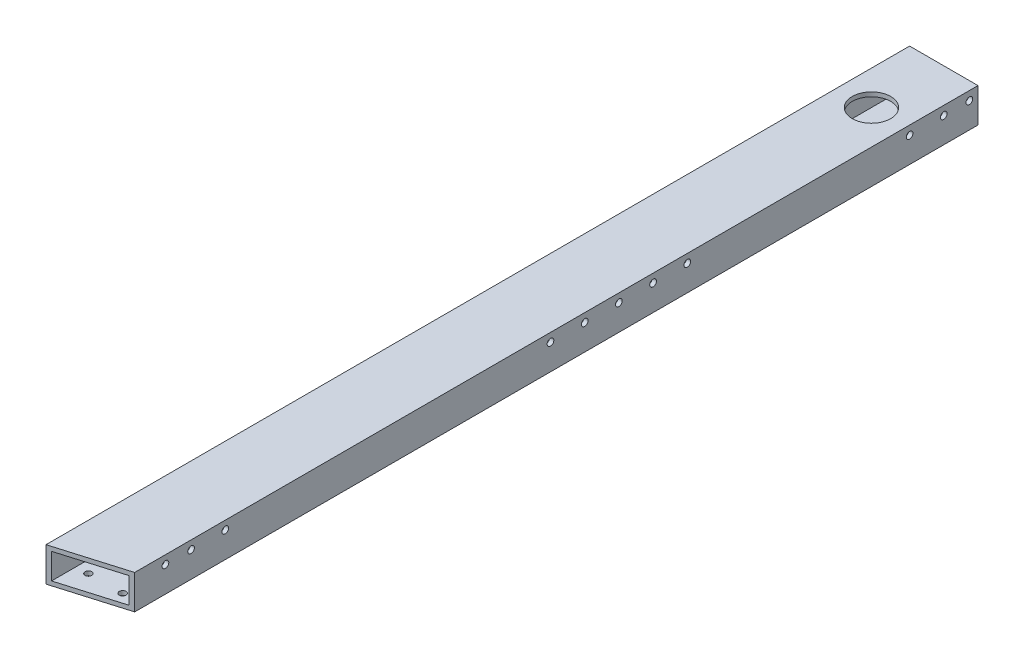
from build123d import *

# Parameters (mm, degrees)
BOSS_EXTRUDE1_DEPTH        = 320.675
BOSS_EXTRUDE1_DEPTH_BACK   = 320.675
SKETCH3_W                  = 50.8
SKETCH3_H                  = 25.4
SKETCH3_W_2                = 44.45
SKETCH3_H_2                = 19.05
CUT_EXTRUDE1_DEPTH         = 323.680609311
CUT_EXTRUDE1_DEPTH_BACK    = 323.680609311
SKETCH8_R                  = 14.2875
CUT_EXTRUDE2_DEPTH         = 323.680609311
F_10_CLEARANCE_HOLE1_D     = 4.9784
F_10_CLEARANCE_HOLE1_DEPTH = 5.08
F_10_CLEARANCE_HOLE1_TIP   = 1.495662253
F_10_CLEARANCE_HOLE2_D     = 4.9784
F_10_CLEARANCE_HOLE2_DEPTH = 3.302
F_10_CLEARANCE_HOLE2_TIP   = 1.495662253
F_10_CLEARANCE_HOLE3_D     = 4.9784


with BuildPart() as part:
    # Sketch3 → Boss-Extrude1 (new, two sides: drawn at the far end of the back side and taken through both)
    with BuildSketch(Plane.XY.offset(-BOSS_EXTRUDE1_DEPTH_BACK)):
        Rectangle(SKETCH3_W, SKETCH3_H)
        Rectangle(SKETCH3_W_2, SKETCH3_H_2, mode=Mode.SUBTRACT)
    extrude(amount=BOSS_EXTRUDE1_DEPTH + BOSS_EXTRUDE1_DEPTH_BACK)

    # Sketch4 → Cut-Extrude1 (cut, two sides: drawn at the far end of the back side and taken through both)
    with BuildSketch(Plane(origin=(0, 12.7, 0), x_dir=(1, 0, 0), z_dir=(0, 1, 0)).offset(-CUT_EXTRUDE1_DEPTH_BACK)):
        Polygon((1322.117470931, -320.675), (25.4, -320.675), (-25.4, -320.675), (25.4, -305.627354456), (1268.718301677, 62.660305034), (3837.350959621, 420.474595165), (3890.750128875, 37.139290131), align=None)
    extrude(amount=CUT_EXTRUDE1_DEPTH + CUT_EXTRUDE1_DEPTH_BACK, mode=Mode.SUBTRACT)

    # Sketch8 → Cut-Extrude2 (cut, through all)
    with BuildSketch(Plane(origin=(0, 12.7, 0), x_dir=(1, 0, 0), z_dir=(0, 1, 0))):
        with Locations(Location((0, 266.954, 0), (0, 0, 180))):
            Circle(SKETCH8_R)
    extrude(amount=-CUT_EXTRUDE2_DEPTH, mode=Mode.SUBTRACT)

    # #10 Clearance Hole1
    with Locations(Plane(origin=(0, -12.7, 0), x_dir=(-1, 0, 0), z_dir=(0, -1, 0))):
        with Locations((-12.116793185, -284.753033923), (13.283206815, -284.753033923), (13.283206815, -301.263033923), (-12.116793185, -301.263033923)):
            Hole(F_10_CLEARANCE_HOLE1_D / 2, depth=F_10_CLEARANCE_HOLE1_DEPTH)
            with Locations((0, 0, -(F_10_CLEARANCE_HOLE1_DEPTH + F_10_CLEARANCE_HOLE1_TIP / 2))):  # 118° drill point
                Cone(0, F_10_CLEARANCE_HOLE1_D / 2, F_10_CLEARANCE_HOLE1_TIP, mode=Mode.SUBTRACT)

    # #10 Clearance Hole2
    with Locations(Plane(origin=(25.4, 0, 0), x_dir=(0, 0, -1), z_dir=(1, 0, 0))):
        with Locations((314.286770585, 6.148316496), (295.236770585, 6.148316496), (269.875, 6.148316496)):
            Hole(F_10_CLEARANCE_HOLE2_D / 2, depth=F_10_CLEARANCE_HOLE2_DEPTH)
            with Locations((0, 0, -(F_10_CLEARANCE_HOLE2_DEPTH + F_10_CLEARANCE_HOLE2_TIP / 2))):  # 118° drill point
                Cone(0, F_10_CLEARANCE_HOLE2_D / 2, F_10_CLEARANCE_HOLE2_TIP, mode=Mode.SUBTRACT)

    # #10 Clearance Hole3 (through all)
    with Locations(Plane(origin=(25.4, 0, 0), x_dir=(0, 0, -1), z_dir=(1, 0, 0))):
        with Locations((104.775, 6.35), (79.375, 6.35), (53.975, 6.35), (28.575, 6.35), (3.175, 6.35), (-238.326683504, 6.388229415), (-263.726683504, 6.388229415), (-282.776683504, 6.388229415)):
            Hole(F_10_CLEARANCE_HOLE3_D / 2)


solid = part.part
